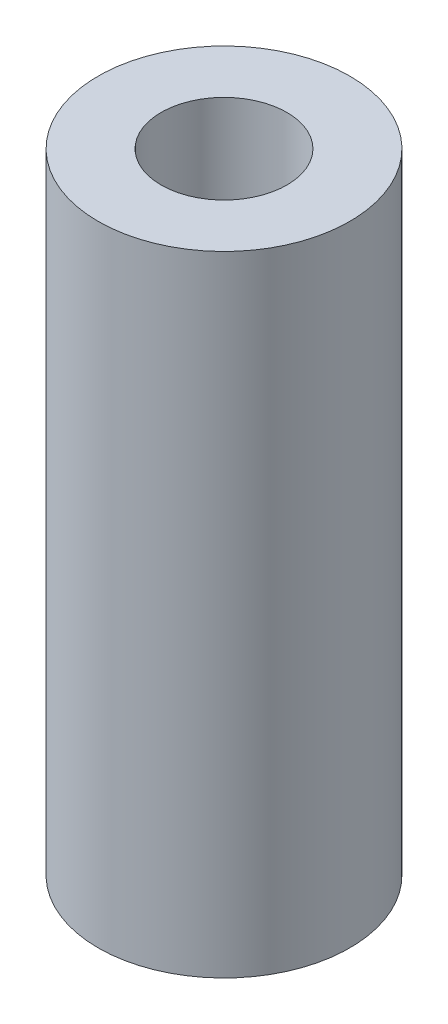
from build123d import *

# Parameters (mm, degrees)
SKETCH1_R           = 6.35
SKETCH1_R_2         = 3.175
BOSS_EXTRUDE1_DEPTH = 31.75


with BuildPart() as part:
    # Sketch1 → Boss-Extrude1 (new body)
    with BuildSketch(Plane(origin=(0, 0, 0), x_dir=(1, 0, 0), z_dir=(0, 1, 0))):
        with Locations(Location((0, 0, 0), (0, 0, 270))):
            Circle(SKETCH1_R)
        with Locations(Location((0, 0, 0), (0, 0, 270))):
            Circle(SKETCH1_R_2, mode=Mode.SUBTRACT)
    extrude(amount=BOSS_EXTRUDE1_DEPTH)


solid = part.part
